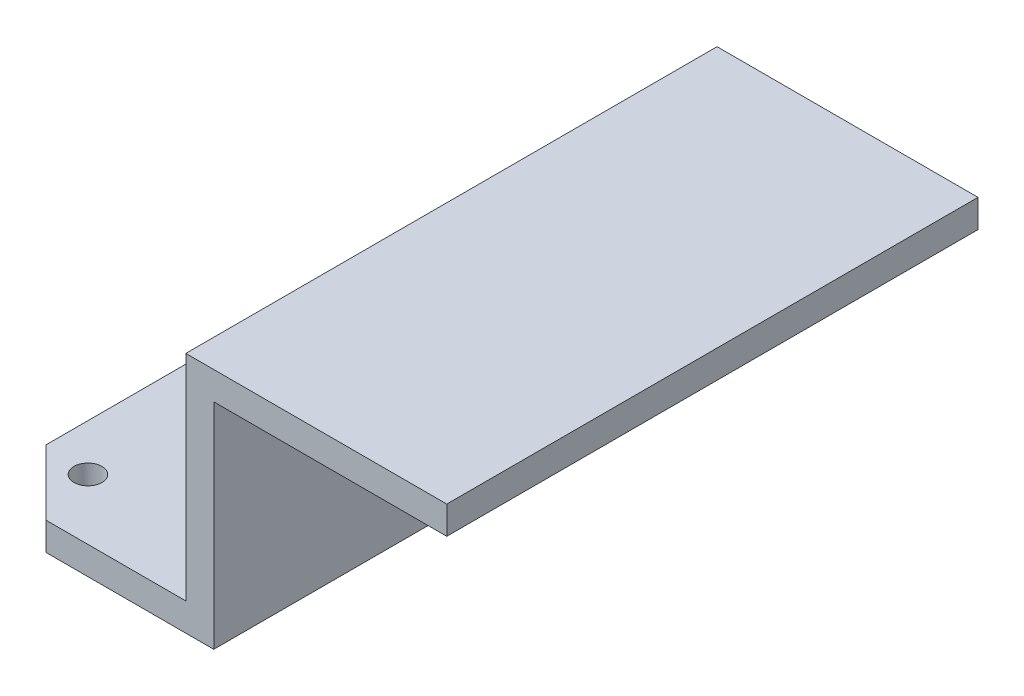
from build123d import *

# Parameters (mm, degrees)
ESTRUSIONE_ESTRUSIONE1_DEPTH = 57
SCHIZZO2_R                   = 1.5
TAGLIO_ESTRUSIONE1_DEPTH     = 57
SMUSSO1_SIZE                 = 7


with BuildPart() as part:
    # Schizzo1 → Estrusione-Estrusione1 (new body)
    with BuildSketch(Plane.XY):
        Polygon((0, 0), (20, 0), (20, 23), (45, 23), (45, 26), (17, 26), (17, 3), (-5, 3), (-5, 0), align=None)
    extrude(amount=ESTRUSIONE_ESTRUSIONE1_DEPTH)

    # Schizzo2 → Taglio-Estrusione1 (cut)
    with BuildSketch(Plane(origin=(0, 3, 0), x_dir=(1, 0, 0), z_dir=(0, 1, 0))):
        with Locations(Location((0, -50.5, 0), (0, 0, 270))):
            Circle(SCHIZZO2_R)
        with Locations(Location((0, -6.5, 0), (0, 0, 270))):
            Circle(SCHIZZO2_R)
    extrude(amount=-TAGLIO_ESTRUSIONE1_DEPTH, mode=Mode.SUBTRACT)

    # Smusso1
    smusso1_edges = [part.edges().sort_by_distance(p)[0] for p in [
        (-5, 1.5, 57),
        (-5, 1.5, 0),
    ]]
    chamfer(smusso1_edges, length=SMUSSO1_SIZE)


solid = part.part
